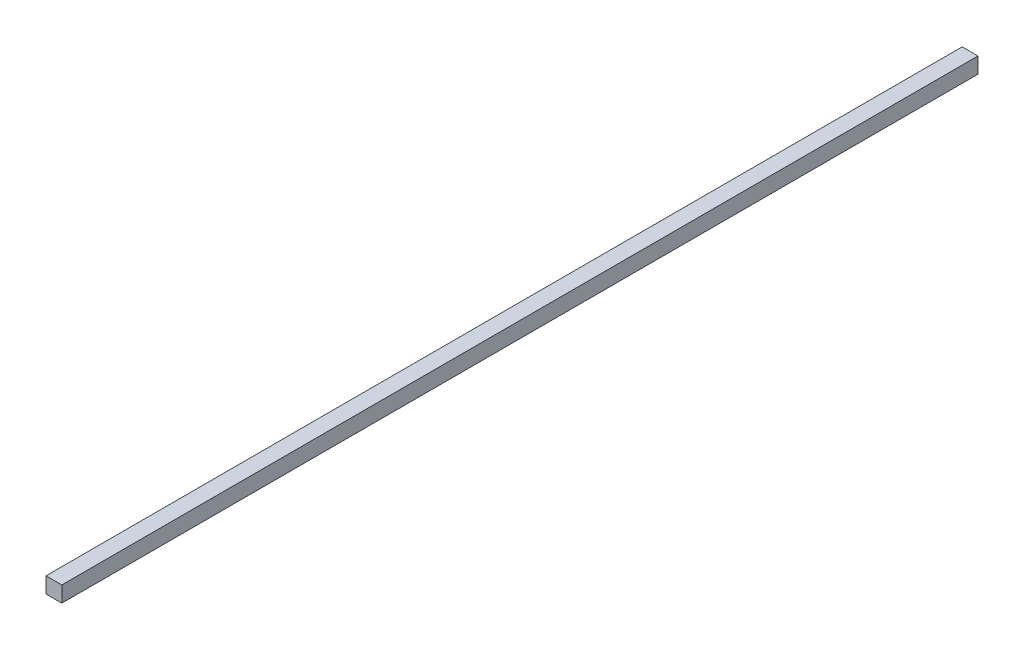
from build123d import *

# Parameters (mm, degrees)
SKETCH1_W           = 40
SKETCH1_H           = 40
BOSS_EXTRUDE1_DEPTH = 2320


with BuildPart() as part:
    # Sketch1 → Boss-Extrude1 (new body)
    with BuildSketch(Plane.XY):
        Rectangle(SKETCH1_W, SKETCH1_H)
    extrude(amount=BOSS_EXTRUDE1_DEPTH)


solid = part.part
